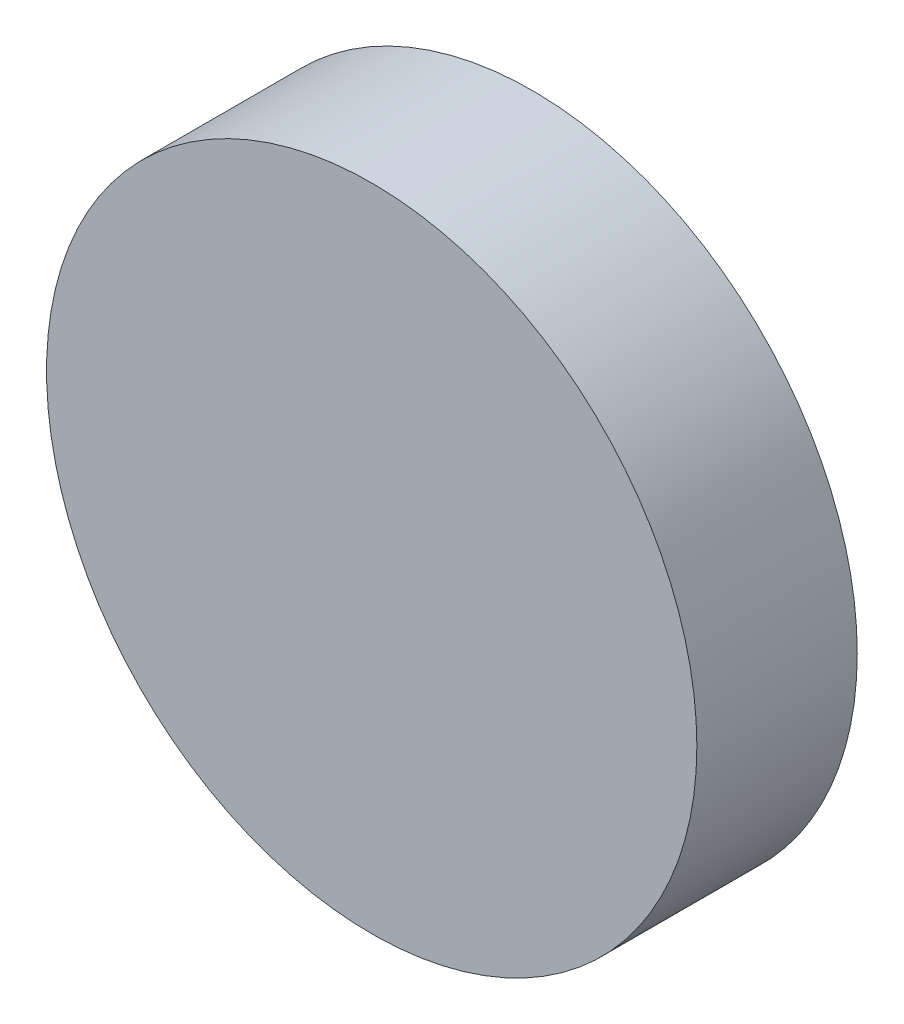
from build123d import *

# Parameters (mm, degrees)
SKETCH_1_R      = 0.202712715
EXTRUDE_1_DEPTH = 0.1


with BuildPart() as part:
    # ｽｹｯﾁ1 → ﾎﾞｽ - 押し出し1 (new body)
    with BuildSketch(Plane.XY):
        Circle(SKETCH_1_R)
    extrude(amount=EXTRUDE_1_DEPTH)


solid = part.part
